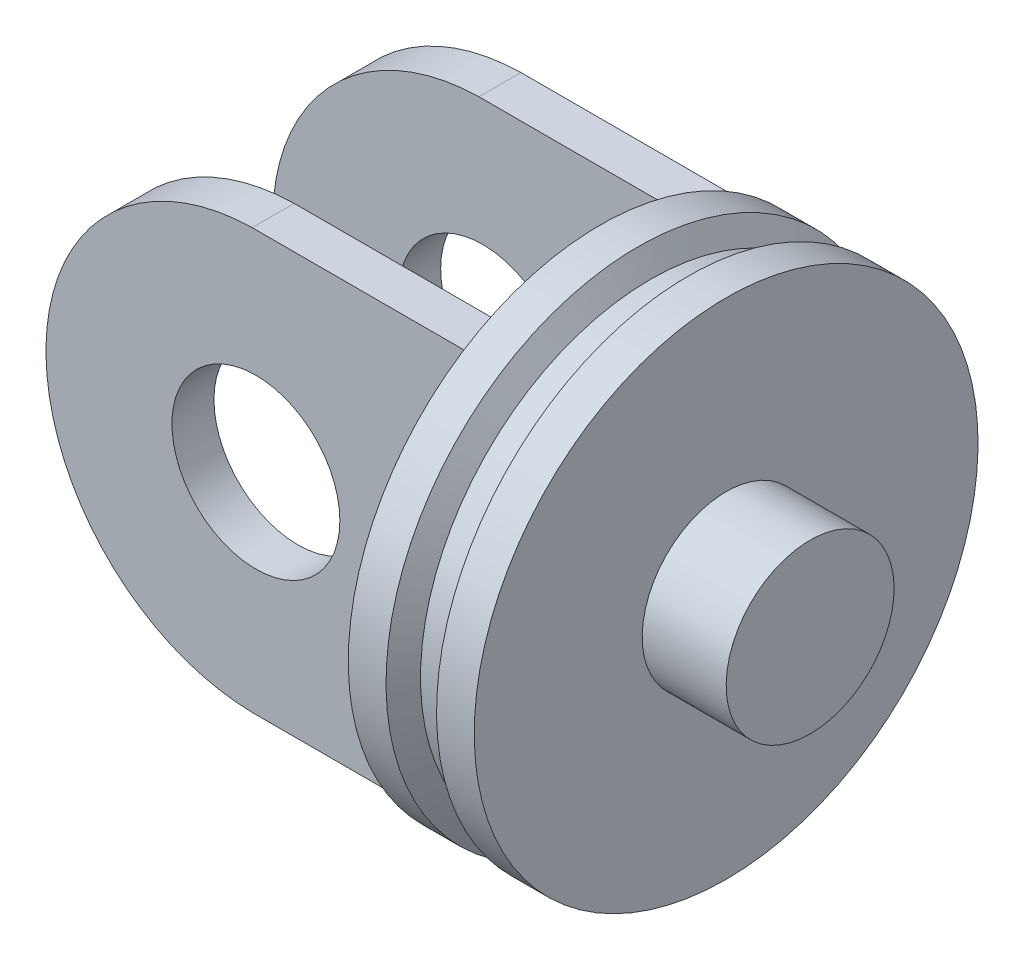
from build123d import *

# Parameters (mm, degrees)
CROQUIS1_ONE_SIDE_W     = 3.003658151
CROQUIS1_ONE_SIDE_H     = 0.614983514
CROQUIS2_W              = 2.5
CROQUIS2_H              = 25
SALIENTE_EXTRUIR1_DEPTH = 25
CORTAR_EXTRUIR1_DEPTH   = 25


with BuildPart() as part:
    # Croquis1 one side → Revolución1 (revolve)
    with BuildSketch(Plane.XY, mode=Mode.PRIVATE) as revoluci_n1_sk:
        Polygon((-3.75, 15), (-3.75, 0), (3.75, 0), (8.75, 0), (8.75, 5), (3.75, 5), (3.75, 15), (1.503658151, 15), (0.751829076, 13.697793843), (-0.751829076, 13.697793843), (-1.503658151, 15), align=None)
        with Locations((0.001829075, 4.692508243)):
            Rectangle(CROQUIS1_ONE_SIDE_W, CROQUIS1_ONE_SIDE_H, mode=Mode.SUBTRACT)
    revolve(revoluci_n1_sk.sketch.rotate(Axis((-10.104371621, 0, 0), (1, 0, 0)), 180), axis=Axis((-10.104371621, 0, 0), (1, 0, 0)))

    # Croquis2 → Saliente-Extruir1 (add)
    with BuildSketch(Plane.ZY.offset(3.75)):
        with Locations((-6.75, 0)):
            Rectangle(CROQUIS2_W, CROQUIS2_H)
        with Locations((6.75, 0)):
            Rectangle(CROQUIS2_W, CROQUIS2_H)
    extrude(amount=SALIENTE_EXTRUIR1_DEPTH)

    # Croquis3 → Cortar-Extruir1 (cut)
    with BuildSketch(Plane.XY.offset(8)):
        with BuildLine():
            Line((-16.469719797, 12.5), (-28.75, 12.5))
            Line((-28.75, 12.5), (-28.75, 0.219719797))
            ThreePointArc((-28.75, 0.219719797), (-25.090200133, 8.840200133), (-16.469719797, 12.5))
        make_face()
        with BuildLine():
            Line((-28.75, -0.219719797), (-28.75, -12.5))
            Line((-28.75, -12.5), (-16.469719797, -12.5))
            ThreePointArc((-16.469719797, -12.5), (-25.090200133, -8.840200133), (-28.75, -0.219719797))
        make_face()
        with BuildLine():
            ThreePointArc((-11.25, 0), (-12.714466094, 3.535533906), (-16.25, 5))
            Line((-16.25, 5), (-16.25, -5))
            ThreePointArc((-16.25, -5), (-12.714466094, -3.535533906), (-11.25, 0))
        make_face()
        with BuildLine():
            Line((-16.25, -5), (-16.25, 5))
            ThreePointArc((-16.25, 5), (-21.25, 0), (-16.25, -5))
        make_face()
    extrude(amount=-CORTAR_EXTRUIR1_DEPTH, mode=Mode.SUBTRACT)


solid = part.part
